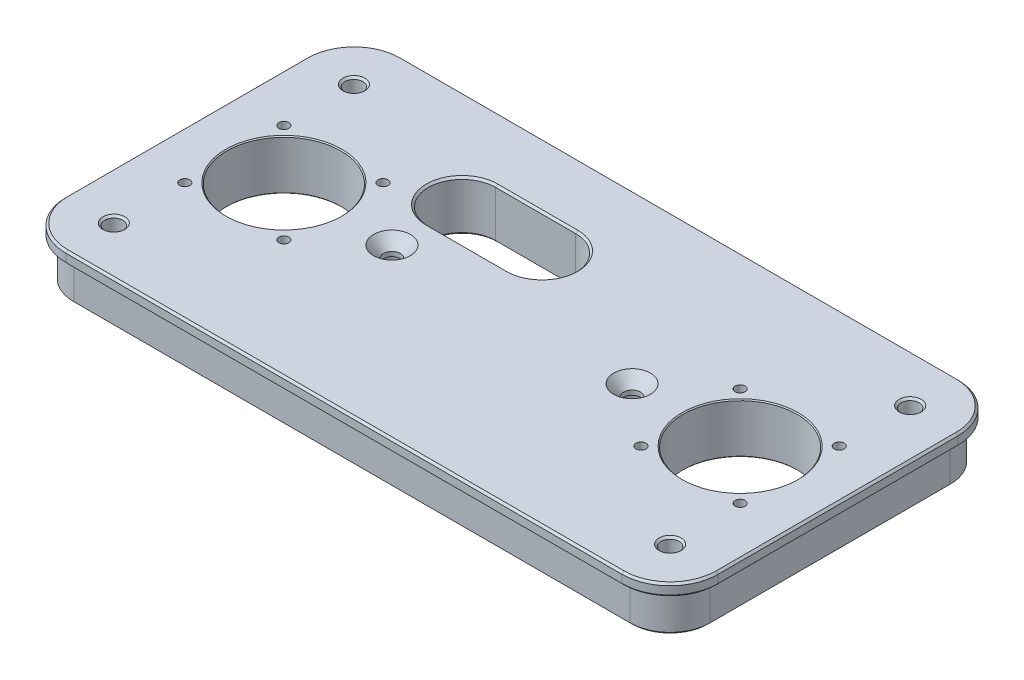
from build123d import *

# Parameters (mm, degrees)
SKETCH1_W                                            = 318
SKETCH1_H                                            = 160
BOSS_EXTRUDE1_DEPTH                                  = 25
SKETCH2_R                                            = 28.5
CUT_EXTRUDE1_DEPTH                                   = 180.738699228
CUT_EXTRUDE2_DEPTH                                   = 180.738699228
CUT_EXTRUDE2_DEPTH_BACK                              = 180.738699228
SKETCH4_R                                            = 9.55
CHAMFER1_SIZE                                        = 0.5
FILLET1_R                                            = 20
M8_CLEARANCE_HOLE1_D                                 = 9
M6X1_0_TAPPED_HOLE1_D                                = 5
SKETCH13_R                                           = 13.411040831
SKETCH13_R_2                                         = 14.724493856
BOSS_EXTRUDE3_DEPTH                                  = 8
CSK_FOR_5_16_FLAT_HEAD_SOCKET_CAP_SCREW1_D           = 8.4328
CSK_FOR_5_16_FLAT_HEAD_SOCKET_CAP_SCREW1_CSINK_D     = 18.4009792
CSK_FOR_5_16_FLAT_HEAD_SOCKET_CAP_SCREW1_CSINK_ANGLE = 82
BOSS_EXTRUDE4_DEPTH                                  = 6
CUT_EXTRUDE3_DEPTH                                   = 186.067555233
CHAMFER4_SIZE                                        = 1
M6X1_0_TAPPED_HOLE2_D                                = 5
M6X1_0_TAPPED_HOLE2_DEPTH                            = 15
M6X1_0_TAPPED_HOLE2_TIP                              = 1.502151548


with BuildPart() as part:
    # Sketch1 → Boss-Extrude1 (new body)
    with BuildSketch(Plane(origin=(0, 0, 0), x_dir=(1, 0, 0), z_dir=(0, 1, 0))):
        Rectangle(SKETCH1_W, SKETCH1_H)
    extrude(amount=BOSS_EXTRUDE1_DEPTH)

    # Sketch2 → Cut-Extrude1 (cut, through all)
    with BuildSketch(Plane(origin=(0, 25, 0), x_dir=(1, 0, 0), z_dir=(0, 1, 0))):
        with Locations(Location((-114, 0, 0), (0, 0, 270))):
            Circle(SKETCH2_R)
        with Locations(Location((114, 0, 0), (0, 0, 270))):
            Circle(SKETCH2_R)
    extrude(amount=-CUT_EXTRUDE1_DEPTH, mode=Mode.SUBTRACT)

    # Sketch4 → Cut-Extrude2 (cut, two sides: drawn at the far end of the back side and taken through both)
    with BuildSketch(Plane(origin=(0, 25, 0), x_dir=(1, 0, 0), z_dir=(0, 1, 0)).offset(-CUT_EXTRUDE2_DEPTH_BACK)):
        with Locations(Location((-60, 0, 0), (0, 0, 270))):
            Circle(SKETCH4_R)
        with Locations(Location((60, 0, 0), (0, 0, 270))):
            Circle(SKETCH4_R)
    extrude(amount=CUT_EXTRUDE2_DEPTH + CUT_EXTRUDE2_DEPTH_BACK, mode=Mode.SUBTRACT)

    # Chamfer1
    chamfer1_edges = [part.edges().sort_by_distance(p)[0] for p in [
        (-114, 0, -28.5),
        (-114, 25, -28.5),
        (114, 0, -28.5),
        (114, 25, -28.5),
        (-60, 0, -9.55),
        (-60, 25, -9.55),
        (60, 0, -9.55),
        (60, 25, -9.55),
    ]]
    chamfer(chamfer1_edges, length=CHAMFER1_SIZE)

    # Fillet1
    fillet1_edges = [part.edges().sort_by_distance(p)[0] for p in [
        (159, 12.5, 80),
        (-159, 12.5, 80),
        (-159, 12.5, -80),
        (159, 12.5, -80),
    ]]
    fillet(fillet1_edges, radius=FILLET1_R)

    # M8 Clearance Hole1 (through all)
    with Locations(Plane.XZ):
        with Locations((-139, -60), (-139, 60), (139, -60), (139, 60)):
            Hole(M8_CLEARANCE_HOLE1_D / 2)

    # M6x1.0 Tapped Hole1 (through all)
    with Locations(Plane(origin=(0, 0, 0), x_dir=(-1, 0, 0), z_dir=(0, -1, 0))):
        with Locations((138.765, -24.765), (89.235, -24.765), (89.235, 24.765), (138.765, 24.765), (-89.235, -24.765), (-138.765, -24.765), (-89.235, 24.765), (-138.765, 24.765)):
            Hole(M6X1_0_TAPPED_HOLE1_D / 2)

    # Sketch13 → Boss-Extrude3 (add)
    with BuildSketch(Plane(origin=(0, 25, 0), x_dir=(1, 0, 0), z_dir=(0, 1, 0))):
        with Locations((60, 0)):
            Circle(SKETCH13_R)
        with Locations((-60, 0)):
            Circle(SKETCH13_R_2)
    extrude(amount=-BOSS_EXTRUDE3_DEPTH)

    # CSK for 5/16 Flat Head Socket Cap Screw1 (through all)
    with Locations(Plane(origin=(0, 25, 0), x_dir=(1, 0, 0), z_dir=(0, 1, 0))):
        with Locations((60, 0), (-60, 0)):
            CounterSinkHole(CSK_FOR_5_16_FLAT_HEAD_SOCKET_CAP_SCREW1_D / 2, CSK_FOR_5_16_FLAT_HEAD_SOCKET_CAP_SCREW1_CSINK_D / 2, counter_sink_angle=CSK_FOR_5_16_FLAT_HEAD_SOCKET_CAP_SCREW1_CSINK_ANGLE)

    # Sketch16 → Boss-Extrude4 (add)
    with BuildSketch(Plane.XZ.offset(-25)):
        with BuildLine():
            Line((163, -60), (163, 60))
            ThreePointArc((163, 60), (155.970562748, 76.970562748), (139, 84))
            Line((139, 84), (-139, 84))
            ThreePointArc((-139, 84), (-155.970562748, 76.970562748), (-163, 60))
            Line((-163, 60), (-163, -60))
            ThreePointArc((-163, -60), (-155.970562748, -76.970562748), (-139, -84))
            Line((-139, -84), (139, -84))
            ThreePointArc((139, -84), (155.970562748, -76.970562748), (163, -60))
        make_face()
        with BuildLine():
            Line((159, 60), (159, -60))
            ThreePointArc((159, -60), (153.142135624, -74.142135624), (139, -80))
            Line((139, -80), (-139, -80))
            ThreePointArc((-139, -80), (-153.142135624, -74.142135624), (-159, -60))
            Line((-159, -60), (-159, 60))
            ThreePointArc((-159, 60), (-153.142135624, 74.142135624), (-139, 80))
            Line((-139, 80), (139, 80))
            ThreePointArc((139, 80), (153.142135624, 74.142135624), (159, 60))
        make_face(mode=Mode.SUBTRACT)
    extrude(amount=BOSS_EXTRUDE4_DEPTH)

    # Sketch17 → Cut-Extrude3 (cut, through all)
    with BuildSketch(Plane.XZ):
        with BuildLine():
            Line((-60, -18.184097247), (-20, -18.184097247))
            ThreePointArc((-20, -18.184097247), (-3.164859361, -35.019237886), (-20, -51.854378525))
            Line((-20, -51.854378525), (-60, -51.854378525))
            ThreePointArc((-60, -51.854378525), (-76.835140639, -35.019237886), (-60, -18.184097247))
        make_face()
    extrude(amount=-CUT_EXTRUDE3_DEPTH, mode=Mode.SUBTRACT)

    # Chamfer4
    chamfer4_edges = [part.edges().sort_by_distance(p)[0] for p in [
        (-134.5, 0, 60),
        (-134.5, 25, 60),
        (-134.5, 0, -60),
        (-134.5, 25, -60),
        (155.970562748, 19, -76.970562748),
        (163, 19, 0),
        (155.970562748, 19, 76.970562748),
        (0, 19, 84),
        (-155.970562748, 19, 76.970562748),
        (-163, 19, 0),
        (-155.970562748, 19, -76.970562748),
        (0, 19, -84),
        (155.970562748, 25, -76.970562748),
        (163, 25, 0),
        (155.970562748, 25, 76.970562748),
        (0, 25, 84),
        (-155.970562748, 25, 76.970562748),
        (-163, 25, 0),
        (-155.970562748, 25, -76.970562748),
        (0, 25, -84),
        (-76.835140639, 25, -35.019237886),
        (-40, 25, -18.184097247),
        (-3.164859361, 25, -35.019237886),
        (-40, 25, -51.854378525),
        (-76.835140639, 0, -35.019237886),
        (-40, 0, -51.854378525),
        (-3.164859361, 0, -35.019237886),
        (-40, 0, -18.184097247),
        (159, 0, 0),
        (0, 0, 80),
        (-159, 0, 0),
        (0, 0, -80),
        (-153.142135624, 0, 74.142135624),
        (-153.142135624, 0, -74.142135624),
        (153.142135624, 0, -74.142135624),
        (153.142135624, 0, 74.142135624),
        (143.5, 0, 60),
        (143.5, 25, 60),
        (143.5, 0, -60),
        (143.5, 25, -60),
    ]]
    chamfer(chamfer4_edges, length=CHAMFER4_SIZE)

    # M6x1.0 Tapped Hole2
    with Locations(Plane(origin=(0, 0, 0), x_dir=(-1, 0, 0), z_dir=(0, -1, 0))):
        with Locations((-75, 70), (-45, 70), (-105, 70), (-15, 70), (15, 70), (45, 70), (75, 70), (105, 70), (-105, -70), (-75, -70), (-45, -70), (-15, -70), (15, -70), (45, -70), (75, -70), (105, -70)):
            Hole(M6X1_0_TAPPED_HOLE2_D / 2, depth=M6X1_0_TAPPED_HOLE2_DEPTH)
            with Locations((0, 0, -(M6X1_0_TAPPED_HOLE2_DEPTH + M6X1_0_TAPPED_HOLE2_TIP / 2))):  # 118° drill point
                Cone(0, M6X1_0_TAPPED_HOLE2_D / 2, M6X1_0_TAPPED_HOLE2_TIP, mode=Mode.SUBTRACT)


solid = part.part
